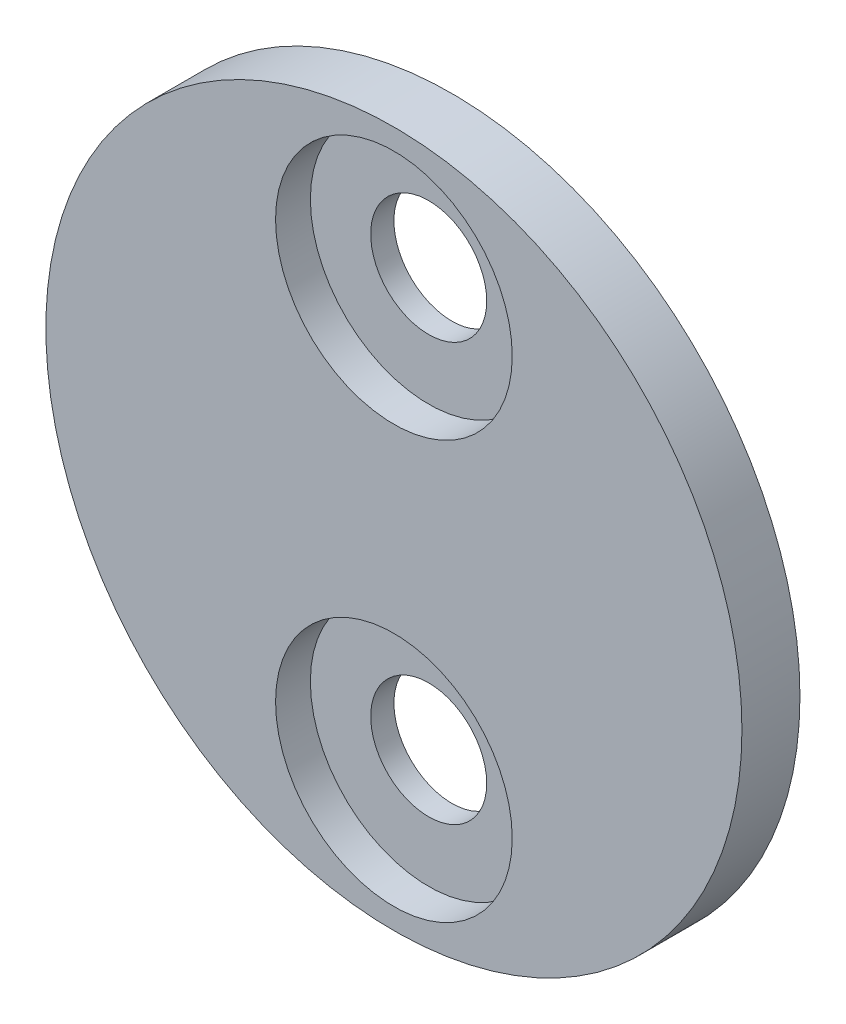
from build123d import *

# Parameters (mm, degrees)
SKETCH2_R           = 2.4
BOSS_EXTRUDE1_DEPTH = 6
SKETCH3_R           = 15
BOSS_EXTRUDE2_DEPTH = 2.5
FILLET1_R           = 2
CUT_EXTRUDE1_DEPTH  = 1.5
SKETCH5_R           = 2.5
CUT_EXTRUDE2_DEPTH  = 23.338307904
CHAMFER1_SIZE       = 0.5
CHAMFER1_SIZE2      = 0.595876796


with BuildPart() as part:
    # Sketch2 → Boss-Extrude1 (new body)
    with BuildSketch(Plane.XY):
        Circle(SKETCH2_R)
    extrude(amount=BOSS_EXTRUDE1_DEPTH)

    # Sketch3 → Boss-Extrude2 (add)
    with BuildSketch(Plane.XY.offset(6)):
        Circle(SKETCH3_R)
    extrude(amount=BOSS_EXTRUDE2_DEPTH)

    # Fillet1
    fillet1_edges = [part.edges().sort_by_distance(p)[0] for p in [
        (-2.4, 0, 6),
    ]]
    fillet(fillet1_edges, radius=FILLET1_R)

    # Sketch4 → Cut-Extrude1 (cut)
    with BuildSketch(Plane.XY.offset(8.5)):
        with BuildLine():
            ThreePointArc((0, 14.1), (-5.1, 9), (0, 3.9))
            Line((0, 3.9), (0, 14.1))
        make_face()
        with BuildLine():
            Line((0, 14.1), (0, 3.9))
            ThreePointArc((0, 3.9), (3.606244584, 5.393755416), (5.1, 9))
            ThreePointArc((5.1, 9), (3.606244584, 12.606244584), (0, 14.1))
        make_face()
        with BuildLine():
            ThreePointArc((0, -3.9), (-5.1, -9), (0, -14.1))
            Line((0, -14.1), (0, -3.9))
        make_face()
        with BuildLine():
            Line((0, -3.9), (0, -14.1))
            ThreePointArc((0, -14.1), (3.606244584, -12.606244584), (5.1, -9))
            ThreePointArc((5.1, -9), (3.606244584, -5.393755416), (0, -3.9))
        make_face()
    extrude(amount=-CUT_EXTRUDE1_DEPTH, mode=Mode.SUBTRACT)

    # Sketch5 → Cut-Extrude2 (cut, through all)
    with BuildSketch(Plane.XY.offset(7)):
        with Locations((0, -9)):
            Circle(SKETCH5_R)
        with Locations((0, 9)):
            Circle(SKETCH5_R)
    extrude(amount=-CUT_EXTRUDE2_DEPTH, mode=Mode.SUBTRACT)

    # Chamfer1
    chamfer1_edges = [part.edges().sort_by_distance(p)[0] for p in [
        (-2.4, 0, 0),
    ]]
    chamfer1_side = [part.faces().sort_by_distance(p)[0] for p in [
        (0, 0, 0),
    ]]
    chamfer(chamfer1_edges, length=CHAMFER1_SIZE, length2=CHAMFER1_SIZE2, reference=chamfer1_side[0])


solid = part.part
